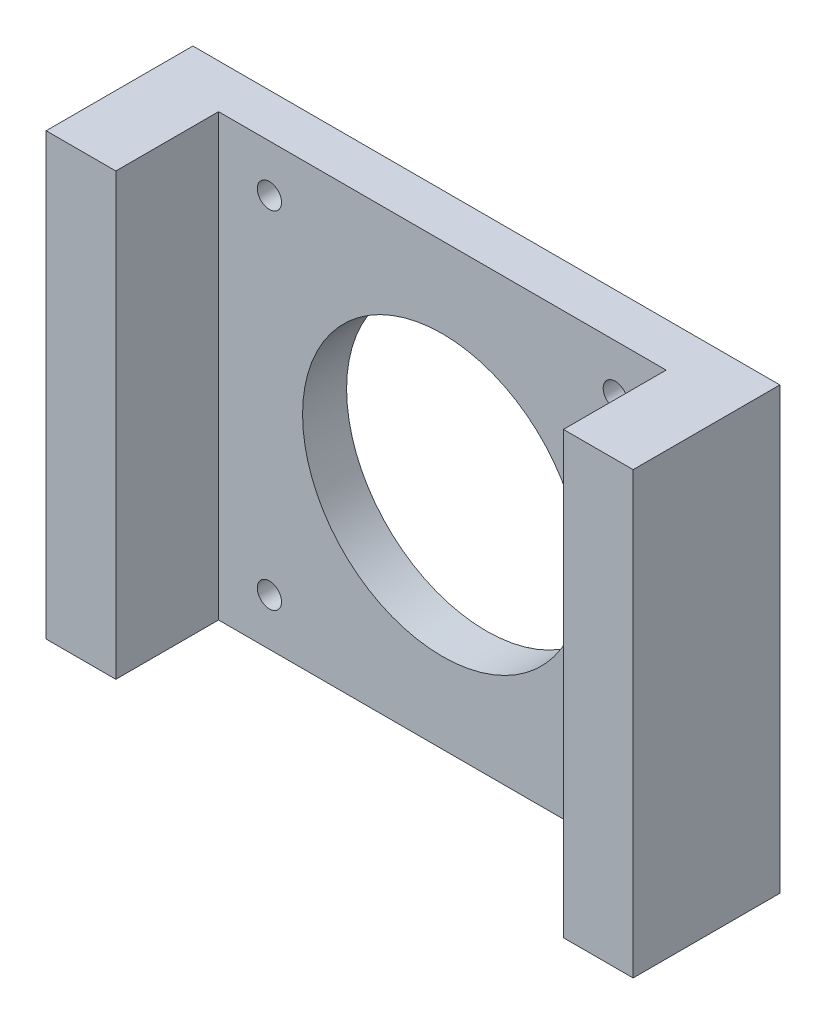
from build123d import *

# Parameters (mm, degrees)
SKETCH_1_W          = 80
SKETCH_1_H          = 60
EXTRUDE_1_DEPTH     = 20
SKETCH_2_W          = 61
SKETCH_2_H          = 60
CUT_EXTRUDE_1_DEPTH = 14
SKETCH_3_R          = 19.05
CUT_EXTRUDE_2_DEPTH = 54.851648071
M4X0_7_1_D          = 3.3


with BuildPart() as part:
    # 草圖1 → 填料-伸長1 (new body)
    with BuildSketch(Plane.XY):
        Rectangle(SKETCH_1_W, SKETCH_1_H)
    extrude(amount=EXTRUDE_1_DEPTH)

    # 草圖2 → 除料-伸長1 (cut)
    with BuildSketch(Plane.XY.offset(20)):
        Rectangle(SKETCH_2_W, SKETCH_2_H)
    extrude(amount=-CUT_EXTRUDE_1_DEPTH, mode=Mode.SUBTRACT)

    # 草圖3 → 除料-伸長2 (cut, through all)
    with BuildSketch(Plane(origin=(0, 0, 0), x_dir=(-1, 0, 0), z_dir=(0, 0, -1))):
        Circle(SKETCH_3_R)
    extrude(amount=-CUT_EXTRUDE_2_DEPTH, mode=Mode.SUBTRACT)

    # M4x0.7 螺紋孔1 (through all)
    with Locations(Plane(origin=(0, 0, 0), x_dir=(-1, 0, 0), z_dir=(0, 0, -1))):
        with Locations((23.57, 23.57), (-23.57, -23.57), (-23.57, 23.57), (23.57, -23.57)):
            Hole(M4X0_7_1_D / 2)


solid = part.part
